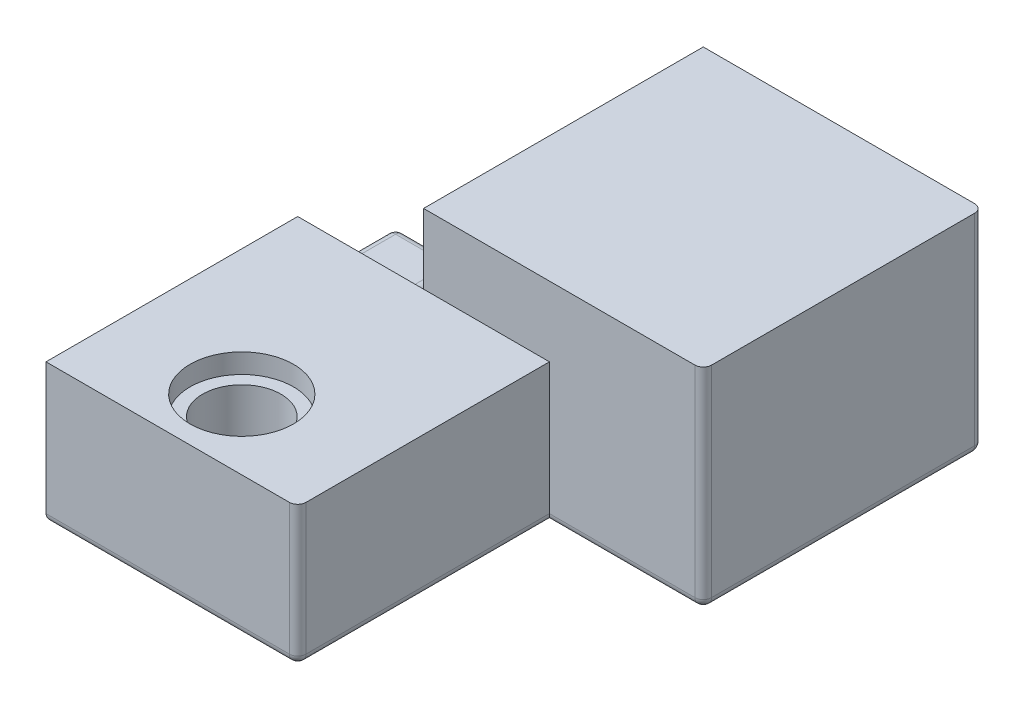
from build123d import *

# Parameters (mm, degrees)
SKETCH1_W           = 100
SKETCH1_H           = 100
BOSS_EXTRUDE1_DEPTH = 50
SKETCH8_W           = 90
SKETCH8_H           = 90
BOSS_EXTRUDE4_DEPTH = 50
SKETCH9_R           = 18.5
CUT_EXTRUDE1_DEPTH  = 7
SKETCH10_R          = 14
CUT_EXTRUDE2_DEPTH  = 25
SKETCH11_W          = 25
SKETCH11_H          = 30
BOSS_EXTRUDE5_DEPTH = 25
SKETCH12_W          = 100
SKETCH12_H          = 100
BOSS_EXTRUDE6_DEPTH = 25
SKETCH13_W          = 20
SKETCH13_H          = 50
CUT_EXTRUDE3_DEPTH  = 50
SKETCH14_R          = 2
CUT_EXTRUDE4_DEPTH  = 15
SKETCH15_R          = 2.5
CUT_EXTRUDE5_DEPTH  = 15
SKETCH16_R          = 3.75
CUT_EXTRUDE6_DEPTH  = 4
FILLET1_R           = 3


with BuildPart() as part:
    # Sketch1 → Boss-Extrude1 (new body)
    with BuildSketch(Plane(origin=(0, 0, 0), x_dir=(1, 0, 0), z_dir=(0, 1, 0))):
        Rectangle(SKETCH1_W, SKETCH1_H)
    extrude(amount=BOSS_EXTRUDE1_DEPTH)

    # Sketch8 → Boss-Extrude4 (add)
    with BuildSketch(Plane(origin=(0, 50, 0), x_dir=(1, 0, 0), z_dir=(0, 1, 0))):
        with Locations((-50, -95)):
            Rectangle(SKETCH8_W, SKETCH8_H)
    extrude(amount=-BOSS_EXTRUDE4_DEPTH)

    # Sketch9 → Cut-Extrude1 (cut)
    with BuildSketch(Plane(origin=(0, 50, 0), x_dir=(1, 0, 0), z_dir=(0, 1, 0))):
        with Locations(Location((-50, -115, 0), (0, 0, 270))):
            Circle(SKETCH9_R)
    extrude(amount=-CUT_EXTRUDE1_DEPTH, mode=Mode.SUBTRACT)

    # Sketch10 → Cut-Extrude2 (cut)
    with BuildSketch(Plane(origin=(0, 50, 0), x_dir=(1, 0, 0), z_dir=(0, 1, 0))):
        with Locations(Location((-50, -115, 0), (0, 0, 270))):
            Circle(SKETCH10_R)
    extrude(amount=-CUT_EXTRUDE2_DEPTH, mode=Mode.SUBTRACT)

    # Sketch11 → Boss-Extrude5 (add)
    with BuildSketch(Plane(origin=(0, 0, 50), x_dir=(-1, 0, 0), z_dir=(0, 0, -1))):
        with Locations((72.5, 25)):
            Rectangle(SKETCH11_W, SKETCH11_H)
    extrude(amount=BOSS_EXTRUDE5_DEPTH)

    # Sketch12 → Boss-Extrude6 (add)
    with BuildSketch(Plane(origin=(0, 50, 0), x_dir=(1, 0, 0), z_dir=(0, 1, 0))):
        Rectangle(SKETCH12_W, SKETCH12_H)
    extrude(amount=BOSS_EXTRUDE6_DEPTH)

    # Sketch13 → Cut-Extrude3 (cut)
    with BuildSketch(Plane(origin=(0, 0, -50), x_dir=(-1, 0, 0), z_dir=(0, 0, -1))):
        with Locations((40, 37.5)):
            Rectangle(SKETCH13_W, SKETCH13_H)
    extrude(amount=-CUT_EXTRUDE3_DEPTH, mode=Mode.SUBTRACT)

    # Sketch14 → Cut-Extrude4 (cut)
    with BuildSketch(Plane.XZ.offset(-10)):
        with Locations(Location((-72.5, 37.5, 0), (0, 0, 270))):
            Circle(SKETCH14_R)
    extrude(amount=-CUT_EXTRUDE4_DEPTH, mode=Mode.SUBTRACT)

    # Sketch15 → Cut-Extrude5 (cut)
    with BuildSketch(Plane.XZ):
        with Locations(Location((-40, -37.5, 0), (0, 0, 270))):
            Circle(SKETCH15_R)
        with Locations((-40, -12.5)):
            Circle(SKETCH15_R)
    extrude(amount=-CUT_EXTRUDE5_DEPTH, mode=Mode.SUBTRACT)

    # Sketch16 → Cut-Extrude6 (cut)
    with BuildSketch(Plane.XZ):
        with Locations(Location((-40, -37.5, 0), (0, 0, 270))):
            Circle(SKETCH16_R)
        with Locations(Location((-40, -12.5, 0), (0, 0, 90))):
            Circle(SKETCH16_R)
    extrude(amount=-CUT_EXTRUDE6_DEPTH, mode=Mode.SUBTRACT)

    # Fillet1
    fillet1_edges = [part.edges().sort_by_distance(p)[0] for p in [
        (22.5, 0, 50),
        (-5, 25, 140),
        (-5, 0, 95),
        (-50, 0, 140),
        (-95, 0, 95),
        (-72.5, 0, 50),
        (-85, 10, 37.5),
        (-85, 40, 37.5),
        (-60, 40, 37.5),
        (-60, 10, 37.5),
        (-85, 25, 25),
        (-72.5, 40, 25),
        (-60, 25, 25),
        (-72.5, 10, 25),
        (0, 0, -50),
        (50, 0, 0),
        (50, 37.5, 50),
        (50, 37.5, -50),
    ]]
    fillet(fillet1_edges, radius=FILLET1_R)


solid = part.part
